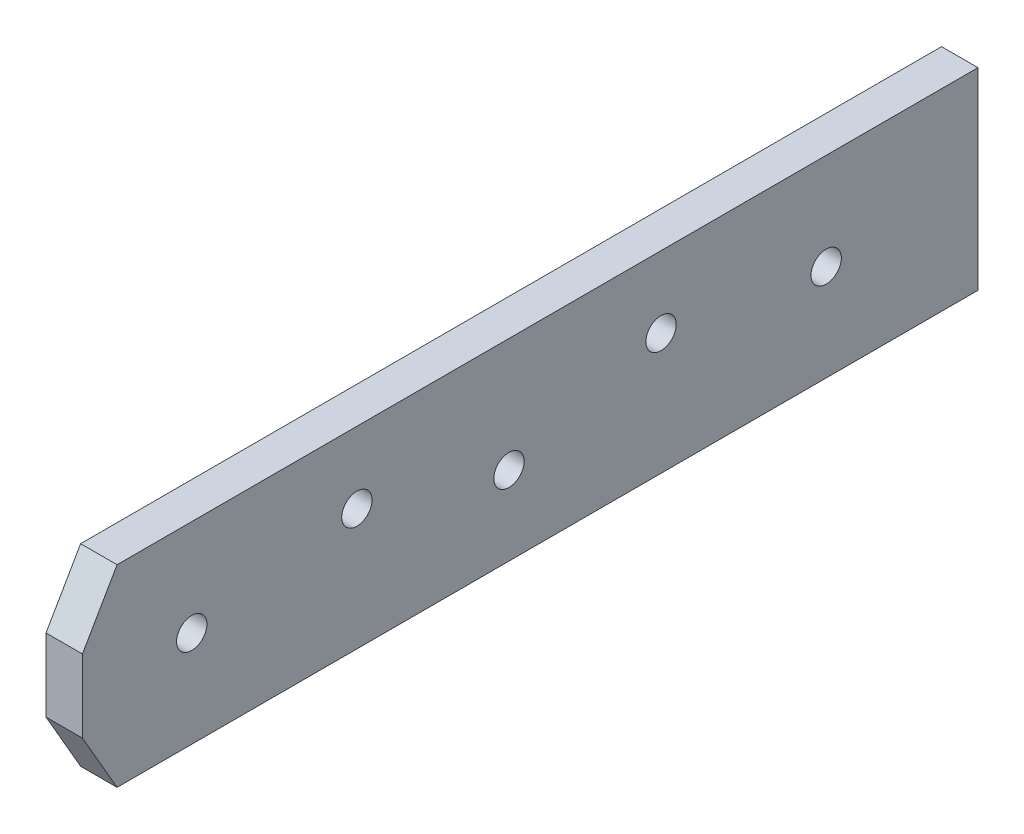
from build123d import *

# Parameters (mm, degrees)
SKETCH2_R           = 2.5
BOSS_EXTRUDE1_DEPTH = 6


with BuildPart() as part:
    # Sketch2 → Boss-Extrude1 (new body)
    with BuildSketch(Plane(origin=(0, 0, 0), x_dir=(0, 0, -1), z_dir=(1, 0, 0))):
        Polygon((-64.527499051, -13), (-70.228832959, -3.125), (-70.228832959, 8.875), (-64.527499051, 18.75), (77.228832959, 18.75), (77.228832959, -13), align=None)
        Circle(SKETCH2_R, mode=Mode.SUBTRACT)
        with Locations((-25.039968051, 7)):
            Circle(SKETCH2_R, mode=Mode.SUBTRACT)
        with Locations((-52.228832959, 2.875)):
            Circle(SKETCH2_R, mode=Mode.SUBTRACT)
        with Locations((52.228832959, 2.875)):
            Circle(SKETCH2_R, mode=Mode.SUBTRACT)
        with Locations((25.039968051, 7)):
            Circle(SKETCH2_R, mode=Mode.SUBTRACT)
    extrude(amount=BOSS_EXTRUDE1_DEPTH)


solid = part.part
